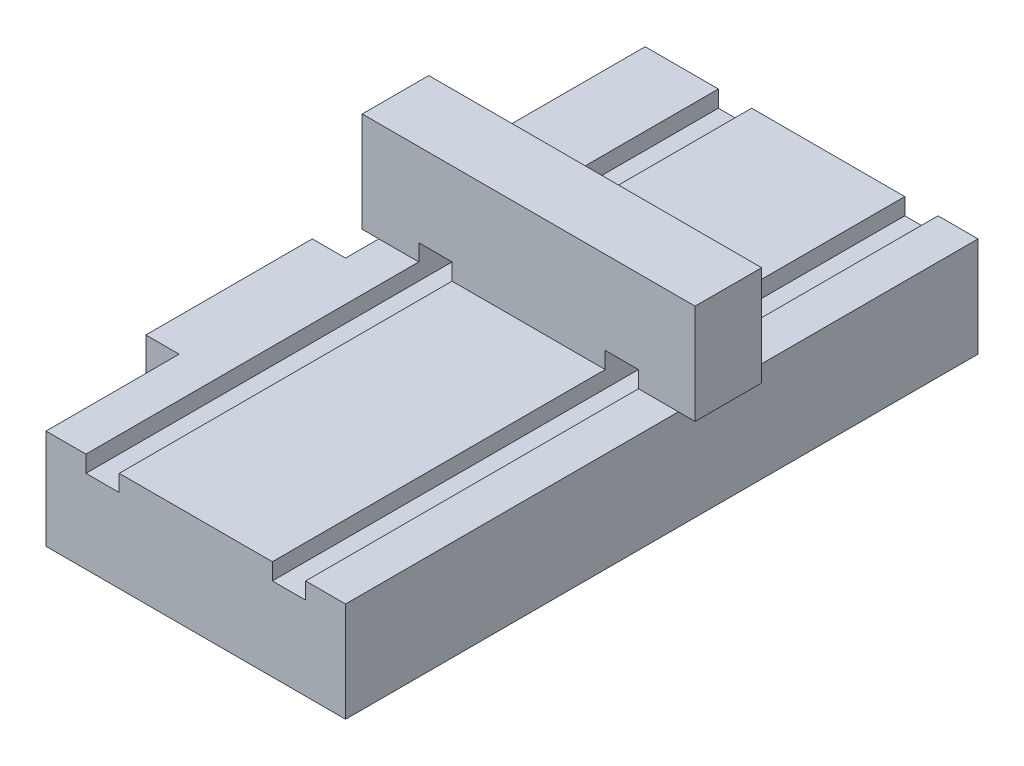
from build123d import *

# Parameters (mm, degrees)
BOSS_EXTRUDE2_DEPTH    = 30
SKETCH2_W              = 10
SKETCH2_H              = 190
CUT_EXTRUDE8_DEPTH     = 5
SKETCH7_W              = 10
SKETCH7_H              = 190
CUT_EXTRUDE9_DEPTH     = 5
SKETCH10_W             = 90
SKETCH10_H             = 20
BOSS_EXTRUDE9_DEPTH    = 30
SKETCH16_W             = 10
SKETCH16_H             = 5
CUT_EXTRUDE11_DEPTH    = 34
SKETCH18_W             = 10
SKETCH18_H             = 5
CUT_EXTRUDE12_DEPTH    = 36
SPLIT3_SURFACE_1_BACK  = 223.935
SPLIT3_SURFACE_1_DEPTH = 447.87
SPLIT3_SURFACE_2_BACK  = 223.935
SPLIT3_SURFACE_2_DEPTH = 447.87
SKETCH24_W             = 20
SKETCH24_H             = 30
BOSS_EXTRUDE10_DEPTH   = 5
SKETCH25_W             = 20
SKETCH25_H             = 30
BOSS_EXTRUDE11_DEPTH   = 5


with BuildPart() as part:
    # Sketch1 → Boss-Extrude2 (new body)
    with BuildSketch(Plane(origin=(0, 0, 0), x_dir=(1, 0, 0), z_dir=(0, 1, 0))):
        Polygon((10, 0), (10, 40), (0, 40), (0, 90), (10, 90), (10, 140), (0, 140), (0, 190), (100, 190), (100, 0), align=None)
    extrude(amount=BOSS_EXTRUDE2_DEPTH)

    # Sketch2 → Cut-Extrude8 (cut)
    with BuildSketch(Plane(origin=(0, 30, 0), x_dir=(1, 0, 0), z_dir=(0, 1, 0))):
        with Locations((27, 95)):
            Rectangle(SKETCH2_W, SKETCH2_H)
    extrude(amount=-CUT_EXTRUDE8_DEPTH, mode=Mode.SUBTRACT)

    # Sketch7 → Cut-Extrude9 (cut)
    with BuildSketch(Plane(origin=(0, 30, 0), x_dir=(1, 0, 0), z_dir=(0, 1, 0))):
        with Locations((83, 95)):
            Rectangle(SKETCH7_W, SKETCH7_H)
    extrude(amount=-CUT_EXTRUDE9_DEPTH, mode=Mode.SUBTRACT)

    # Sketch10 → Boss-Extrude9 (add)
    with BuildSketch(Plane(origin=(0, 30, 0), x_dir=(1, 0, 0), z_dir=(0, 1, 0))):
        with Locations((55, 110)):
            Rectangle(SKETCH10_W, SKETCH10_H)
    extrude(amount=BOSS_EXTRUDE9_DEPTH)

    # Sketch16 → Cut-Extrude11 (cut)
    with BuildSketch(Plane(origin=(0, 0, -120), x_dir=(-1, 0, 0), z_dir=(0, 0, -1))):
        with Locations((-83, 32.5)):
            Rectangle(SKETCH16_W, SKETCH16_H)
    extrude(amount=-CUT_EXTRUDE11_DEPTH, mode=Mode.SUBTRACT)

    # Sketch18 → Cut-Extrude12 (cut)
    with BuildSketch(Plane(origin=(0, 0, -120), x_dir=(-1, 0, 0), z_dir=(0, 0, -1))):
        with Locations((-27, 32.5)):
            Rectangle(SKETCH18_W, SKETCH18_H)
    extrude(amount=-CUT_EXTRUDE12_DEPTH, mode=Mode.SUBTRACT)


with BuildPart() as body_2:
    # Split3: the piece behind the surface
    add(part.part)
    # Split3 surface: a surface, the sketch's curves swept straight by 447.87 mm
    with BuildLine(Plane.ZY.offset(-10).offset(-SPLIT3_SURFACE_1_BACK), mode=Mode.PRIVATE) as split3_surface_1_path:
        Line((-120, 30), (-100, 30))
    split3_surface_1 = Shell.extrude(split3_surface_1_path.wire(), (-1 * SPLIT3_SURFACE_1_DEPTH, 0 * SPLIT3_SURFACE_1_DEPTH, 0 * SPLIT3_SURFACE_1_DEPTH))
    split(bisect_by=split3_surface_1, keep=Keep.BOTTOM)


with BuildPart() as part_1:
    add(part.part)

    # Split3: split by a surface, the side it looks to stays
    # Split3 surface: a surface, the sketch's curves swept straight by 447.87 mm
    with BuildLine(Plane.ZY.offset(-10).offset(-SPLIT3_SURFACE_2_BACK), mode=Mode.PRIVATE) as split3_surface_2_path:
        Line((-120, 30), (-100, 30))
    split3_surface_2 = Shell.extrude(split3_surface_2_path.wire(), (-1 * SPLIT3_SURFACE_2_DEPTH, 0 * SPLIT3_SURFACE_2_DEPTH, 0 * SPLIT3_SURFACE_2_DEPTH))
    split(bisect_by=split3_surface_2, keep=Keep.TOP)

    add(body_2.part)  # Boss-Extrude10 merges body 2
    # Sketch24 → Boss-Extrude10 (add)
    with BuildSketch(Plane.ZY.offset(-10)):
        with Locations((-110, 45)):
            Rectangle(SKETCH24_W, SKETCH24_H)
    extrude(amount=BOSS_EXTRUDE10_DEPTH)

    # Sketch25 → Boss-Extrude11 (add)
    with BuildSketch(Plane(origin=(100, 0, 0), x_dir=(0, 0, -1), z_dir=(1, 0, 0))):
        with Locations((110, 45)):
            Rectangle(SKETCH25_W, SKETCH25_H)
    extrude(amount=BOSS_EXTRUDE11_DEPTH)


solid = part_1.part
